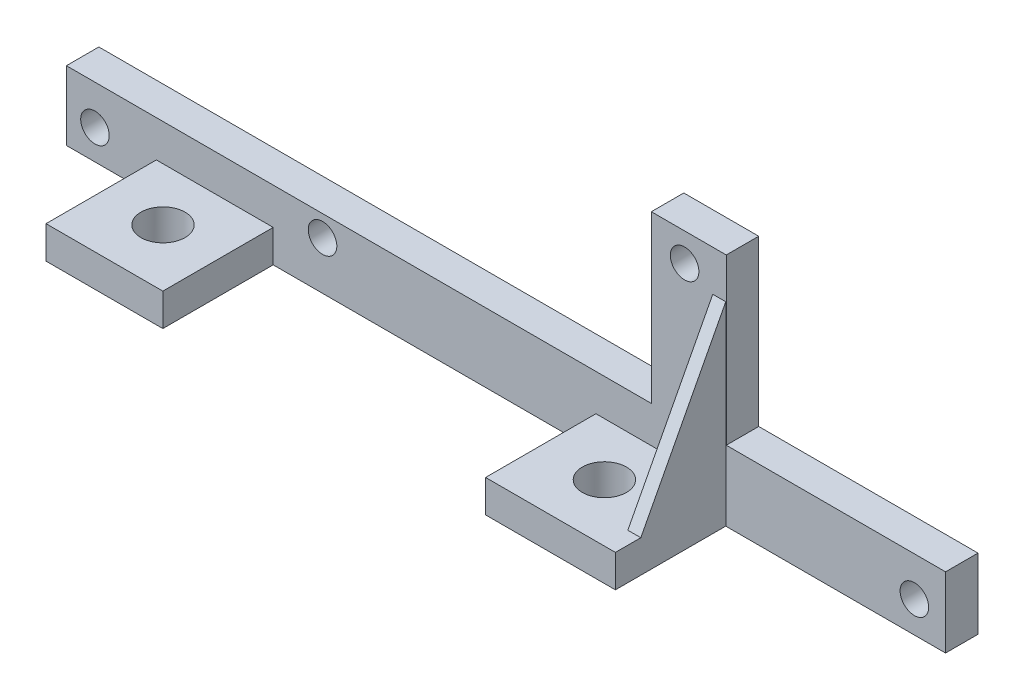
from build123d import *

# Parameters (mm, degrees)
SKETCH1_W           = 86
SKETCH1_H           = 23
BOSS_EXTRUDE1_DEPTH = 3.175
BOSS_EXTRUDE2_DEPTH = 3.175
RIB4_REACH          = 68.401
SKETCH11_WALL_W     = 152.68434621
SKETCH11_WALL_H     = 2.54
SKETCH17_W          = 12.7
SKETCH17_H          = 10.795
CUT_EXTRUDE1_DEPTH  = 50.945290319
SKETCH18_R          = 2.159
CUT_EXTRUDE2_DEPTH  = 127
SKETCH19_R          = 1.397
CUT_EXTRUDE3_DEPTH  = 47.652019249
SKETCH21_W          = 1.27
SKETCH21_H          = 10.795
CUT_EXTRUDE4_DEPTH  = 50.945290319
SKETCH23_W          = 57.219873646
SKETCH23_H          = 16.240764414
SKETCH23_W_2        = 21.450294578
SKETCH23_H_2        = 16.117794019
CUT_EXTRUDE5_DEPTH  = 47.652019249


with BuildPart() as part:
    # Sketch1 → Boss-Extrude1 (new body)
    with BuildSketch(Plane.XY):
        Rectangle(SKETCH1_W, SKETCH1_H)
    extrude(amount=-BOSS_EXTRUDE1_DEPTH)

    # Sketch3 → Boss-Extrude2 (add)
    with BuildSketch(Plane(origin=(0, -11.5, 0), x_dir=(-1, 0, 0), z_dir=(0, -1, 0))):
        Polygon((34.200000011, 0), (34.200000011, -10.795), (8.80000001, -10.795), (8.800000011, 0), align=None)
        Polygon((-34.200000011, 0), (-34.200000011, -10.795), (-8.80000001, -10.795), (-8.800000011, 0), align=None)
    extrude(amount=-BOSS_EXTRUDE2_DEPTH)

    # Sketch11 wall → Rib4 (add, up to next)
    with BuildSketch(Plane(origin=(-21.500000011, -0.407189587, 4.154640606), x_dir=(-5.6e-11, -0.885499596527, 0.46464014522), z_dir=(0, 0.46464014522, 0.885499596527)), mode=Mode.PRIVATE) as rib4_sk1:
        Rectangle(SKETCH11_WALL_W, SKETCH11_WALL_H)
    rib4_tool1 = extrude(rib4_sk1.sketch, amount=-RIB4_REACH, mode=Mode.PRIVATE) - part.part
    rib4 = rib4_tool1.solids().sort_by_distance((-21.500000011, -0.407189587, 4.154640606))[0]
    add(rib4)

    # Mirror1: Rib4 across plane
    add(rib4.mirror(Plane(origin=(0, 0, 0), x_dir=(0, 0, 1), z_dir=(1, 0, 0))))

    # Sketch17 → Cut-Extrude1 (cut, through all)
    with BuildSketch(Plane(origin=(0, 11.5, 0), x_dir=(1, 0, 0), z_dir=(0, 1, 0))):
        with Locations((-15.15000001, -5.3975)):
            Rectangle(SKETCH17_W, SKETCH17_H)
        with Locations((27.850000011, -5.3975)):
            Rectangle(SKETCH17_W, SKETCH17_H)
    extrude(amount=-CUT_EXTRUDE1_DEPTH, mode=Mode.SUBTRACT)

    # Sketch18 → Cut-Extrude2 (cut)
    with BuildSketch(Plane(origin=(0, 11.5, 0), x_dir=(1, 0, 0), z_dir=(0, 1, 0))):
        with Locations(Location((-28.373739812, -5.177433052, 0), (0, 0, 270))):
            Circle(SKETCH18_R)
        with Locations(Location((14.806260188, -5.177433052, 0), (0, 0, 90))):
            Circle(SKETCH18_R)
    extrude(amount=-CUT_EXTRUDE2_DEPTH, mode=Mode.SUBTRACT)

    # Sketch19 → Cut-Extrude3 (cut, through all)
    with BuildSketch(Plane(origin=(0, 0, -3.175), x_dir=(-1, 0, 0), z_dir=(0, 0, -1))):
        with Locations((-39.952, -8.452)):
            Circle(SKETCH19_R)
        with Locations((-17.473, 8.7438)):
            Circle(SKETCH19_R)
        with Locations((17.9429, -6.801)):
            Circle(SKETCH19_R)
        with Locations((40.206, -8.579)):
            Circle(SKETCH19_R)
    extrude(amount=-CUT_EXTRUDE3_DEPTH, mode=Mode.SUBTRACT)

    # Sketch21 → Cut-Extrude4 (cut, through all)
    with BuildSketch(Plane(origin=(0, 11.5, 0), x_dir=(1, 0, 0), z_dir=(0, 1, 0))):
        with Locations((-22.13500001, -5.3975)):
            Rectangle(SKETCH21_W, SKETCH21_H)
    extrude(amount=-CUT_EXTRUDE4_DEPTH, mode=Mode.SUBTRACT)

    # Sketch23 → Cut-Extrude5 (cut, through all)
    with BuildSketch(Plane(origin=(0, 0, -3.175), x_dir=(-1, 0, 0), z_dir=(0, 0, -1))):
        with Locations((14.390063177, 3.379617793)):
            Rectangle(SKETCH23_W, SKETCH23_H)
        with Locations((-32.274852711, 3.44110299)):
            Rectangle(SKETCH23_W_2, SKETCH23_H_2)
    extrude(amount=-CUT_EXTRUDE5_DEPTH, mode=Mode.SUBTRACT)


solid = part.part
